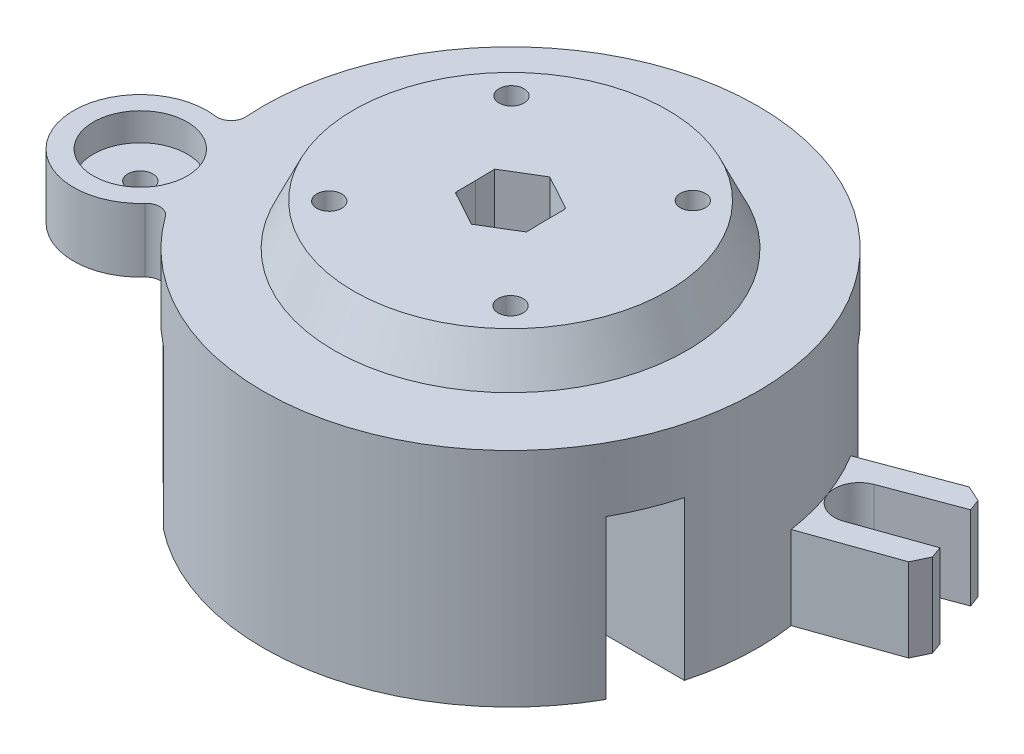
from build123d import *

# Parameters (mm, degrees)
SKETCH2_R           = 45.212
SKETCH2_R_2         = 32.258
BOSS_EXTRUDE3_DEPTH = 40.64
SKETCH4_R           = 32.258
BOSS_EXTRUDE4_DEPTH = 7.62
BOSS_EXTRUDE4_TAPER = 25
CUT_EXTRUDE1_DEPTH  = 81.10791158
SKETCH7_R           = 2.286
CUT_EXTRUDE2_DEPTH  = 81.107911519
BOSS_EXTRUDE8_START = -7.62
BOSS_EXTRUDE8_DEPTH = 11.684
SKETCH18_R          = 8.567257543
CUT_EXTRUDE3_DEPTH  = 5.08
SKETCH19_R          = 2.286
CUT_EXTRUDE4_DEPTH  = 85.454467418
BOSS_EXTRUDE9_START = -15.24
BOSS_EXTRUDE9_DEPTH = 15.24
CUT_EXTRUDE5_START  = -28.956
SKETCH21_R          = 2.286
CUT_EXTRUDE5_DEPTH  = 28.956
CIRPATTERN1_COUNT   = 2
CUT_EXTRUDE6_DEPTH  = 91.648631066


with BuildPart() as part:
    # Sketch2 → Boss-Extrude3 (new body)
    # profile 1 of 2: a face of its own
    with BuildSketch(Plane(origin=(0, 0, 0), x_dir=(1, 0, 0), z_dir=(0, 1, 0))):
        with Locations(Location((0, 0, 0), (0, 0, 270))):
            Circle(SKETCH2_R)
        Circle(SKETCH2_R_2, mode=Mode.SUBTRACT)
    # profile 2 of 2: a face of its own
    with BuildSketch(Plane(origin=(0, 0, 0), x_dir=(1, 0, 0), z_dir=(0, 1, 0))):
        Circle(SKETCH2_R_2)
        Polygon((0, 6.35), (-6.35, 3.483506942), (-6.35, -3.483506942), (0, -6.35), (6.35, -3.483506942), (6.35, 3.483506942), align=None, mode=Mode.SUBTRACT)
    extrude(amount=-BOSS_EXTRUDE3_DEPTH)

    # Sketch4 → Boss-Extrude4 (add)
    with BuildSketch(Plane(origin=(0, 0, 0), x_dir=(1, 0, 0), z_dir=(0, 1, 0))):
        Circle(SKETCH4_R)
    extrude(amount=BOSS_EXTRUDE4_DEPTH, taper=BOSS_EXTRUDE4_TAPER)

    # Sketch6 → Cut-Extrude1 (cut, through all)
    with BuildSketch(Plane(origin=(0, -40.64, 0), x_dir=(-1, 0, 0), z_dir=(0, -1, 0))):
        Polygon((6.35, -3.483506942), (0, -6.35), (-6.35, -3.483506942), (-6.35, 3.483506942), (0, 6.35), (6.35, 3.483506942), align=None)
    extrude(amount=-CUT_EXTRUDE1_DEPTH, mode=Mode.SUBTRACT)

    # Sketch7 → Cut-Extrude2 (cut, through all)
    with BuildSketch(Plane(origin=(0, 7.62, 0), x_dir=(1, 0, 0), z_dir=(0, 1, 0))):
        with Locations(Location((-16.495222192, 16.6624, 0), (0, 0, 270))):
            Circle(SKETCH7_R)
        with Locations(Location((16.6624, 16.6624, 0), (0, 0, 270))):
            Circle(SKETCH7_R)
        with Locations(Location((16.6624, -16.6624, 0), (0, 0, 270))):
            Circle(SKETCH7_R)
        with Locations(Location((-16.495222192, -16.6624, 0), (0, 0, 270))):
            Circle(SKETCH7_R)
    extrude(amount=-CUT_EXTRUDE2_DEPTH, mode=Mode.SUBTRACT)

    # Sketch12 → Boss-Extrude8 (add)
    with BuildSketch(Plane(origin=(0, 7.62, 0), x_dir=(1, 0, 0), z_dir=(0, 1, 0)).offset(BOSS_EXTRUDE8_START)):
        with BuildLine():
            ThreePointArc((-45.091998917, -3.291895759), (-45.888251869, -5.330050438), (-47.973633707, -5.992829324))
            ThreePointArc((-47.973633707, -5.992829324), (-61.102572974, -22.2395178), (-40.602051954, -26.246083736))
            ThreePointArc((-40.602051954, -26.246083736), (-38.578530729, -25.413344212), (-36.658465006, -26.462839746))
            ThreePointArc((-36.658465006, -26.462839746), (-42.485382771, -15.46341472), (-45.091998917, -3.291895759))
        make_face()
    extrude(amount=-BOSS_EXTRUDE8_DEPTH)

    # Sketch18 → Cut-Extrude3 (cut)
    with BuildSketch(Plane(origin=(0, 0, 0), x_dir=(1, 0, 0), z_dir=(0, 1, 0))):
        with Locations(Location((-49.645840541, -18.069608212, 0), (0, 0, 270))):
            Circle(SKETCH18_R)
    extrude(amount=-CUT_EXTRUDE3_DEPTH, mode=Mode.SUBTRACT)

    # Sketch19 → Cut-Extrude4 (cut, through all)
    with BuildSketch(Plane(origin=(0, -5.08, 0), x_dir=(1, 0, 0), z_dir=(0, 1, 0))):
        with Locations(Location((-49.645840541, -18.069608212, 0), (0, 0, 270))):
            Circle(SKETCH19_R)
    extrude(amount=-CUT_EXTRUDE4_DEPTH, mode=Mode.SUBTRACT)

    # Sketch20 → Boss-Extrude9 (add)
    with BuildSketch(Plane.XZ.offset(40.64).offset(BOSS_EXTRUDE9_START)):
        with BuildLine():
            ThreePointArc((42.485382852, -15.463414497), (44.831385262, -12.89196184), (48.307822394, -12.717373918))
            Line((48.307822394, -12.717373918), (61.237093085, -17.295868799))
            Line((61.237093085, -17.295868799), (62.000175566, -15.140990351))
            Line((62.000175566, -15.140990351), (60.601893265, -12.209430544))
            Line((60.601893265, -12.209430544), (44.72934622, -6.588666841))
            ThreePointArc((44.72934622, -6.588666841), (43.832551012, -11.082978649), (42.485382852, -15.463414497))
        make_face()
        with BuildLine():
            ThreePointArc((45.180509286, -21.309596065), (42.629626793, -18.941243028), (42.485382852, -15.463414497))
            ThreePointArc((42.485382852, -15.463414497), (40.701683588, -19.684966271), (38.499780526, -23.704257918))
            Line((38.499780526, -23.704257918), (54.271814253, -29.601179693))
            Line((54.271814253, -29.601179693), (57.22733096, -28.254273131))
            Line((57.22733096, -28.254273131), (58.027905034, -26.113040506))
            Line((58.027905034, -26.113040506), (45.180509286, -21.309596065))
        make_face()
    extrude(amount=BOSS_EXTRUDE9_DEPTH)

    # Sketch21 → Cut-Extrude5 (cut)
    # profile 1 of 2: a face of its own
    with BuildSketch(Plane.XZ.offset(40.64).offset(CUT_EXTRUDE5_START)):
        with BuildLine():
            Line((-20.08732464, 27.438707345), (-28.082012675, 35.43339538))
            ThreePointArc((-28.082012675, 35.43339538), (-31.885487137, 32.053715136), (-35.285134805, 28.268077504))
            Line((-35.285134805, 28.268077504), (-27.271504992, 20.254502449))
            Line((-27.271504992, 20.254502449), (-30.86360744, 16.662375455))
            Line((-30.86360744, 16.662375455), (-23.679427089, 9.478195103))
            ThreePointArc((-23.679427089, 9.478195103), (-9.311017295, 9.478195103), (-9.311017295, 23.846604897))
            Line((-9.311017295, 23.846604897), (-16.495222192, 31.030809794))
            Line((-16.495222192, 31.030809794), (-20.08732464, 27.438707345))
        make_face()
        with Locations(Location((-16.495222192, 16.6624, 0), (0, 0, 90))):
            Circle(SKETCH21_R, mode=Mode.SUBTRACT)
    # profile 2 of 2: a face of its own
    with BuildSketch(Plane.XZ.offset(40.64).offset(CUT_EXTRUDE5_START)):
        with BuildLine():
            ThreePointArc((16.6624, 26.8224), (6.5024, 16.6624), (16.6624, 6.5024))
            Line((16.6624, 6.5024), (26.8224, 6.5024))
            Line((26.8224, 6.5024), (26.8224, 11.844066963))
            Line((26.8224, 11.844066963), (43.63304965, 11.844066963))
            ThreePointArc((43.63304965, 11.844066963), (41.873887087, 17.050000709), (39.496151472, 22.004066963))
            Line((39.496151472, 22.004066963), (25.304864582, 22.004066963))
            Line((25.304864582, 22.004066963), (25.304864582, 26.8224))
            Line((25.304864582, 26.8224), (16.6624, 26.8224))
        make_face()
        with Locations(Location((16.6624, 16.6624, 0), (0, 0, 90))):
            Circle(SKETCH21_R, mode=Mode.SUBTRACT)
    cut_extrude5 = extrude(amount=CUT_EXTRUDE5_DEPTH, mode=Mode.SUBTRACT)

    # CirPattern1: Cut-Extrude5 ×2 about axis
    cirpattern1_axis = Axis((0, 0, 0), (0, 1, 0))
    for i in range(1, CIRPATTERN1_COUNT):
        add(cut_extrude5.rotate(cirpattern1_axis, i * 360 / CIRPATTERN1_COUNT), mode=Mode.SUBTRACT)

    # Sketch22 → Cut-Extrude6 (cut, through all)
    with BuildSketch(Plane(origin=(0, 7.62, 0), x_dir=(1, 0, 0), z_dir=(0, 1, 0))):
        Polygon((6.428560964, -3.526604212), (6.268409318, 3.803994999), (-0.160151646, 7.33059921), (-6.428560964, 3.526604212), (-6.268409318, -3.803994999), (0.160151646, -7.33059921), align=None)
    extrude(amount=-CUT_EXTRUDE6_DEPTH, mode=Mode.SUBTRACT)


solid = part.part
